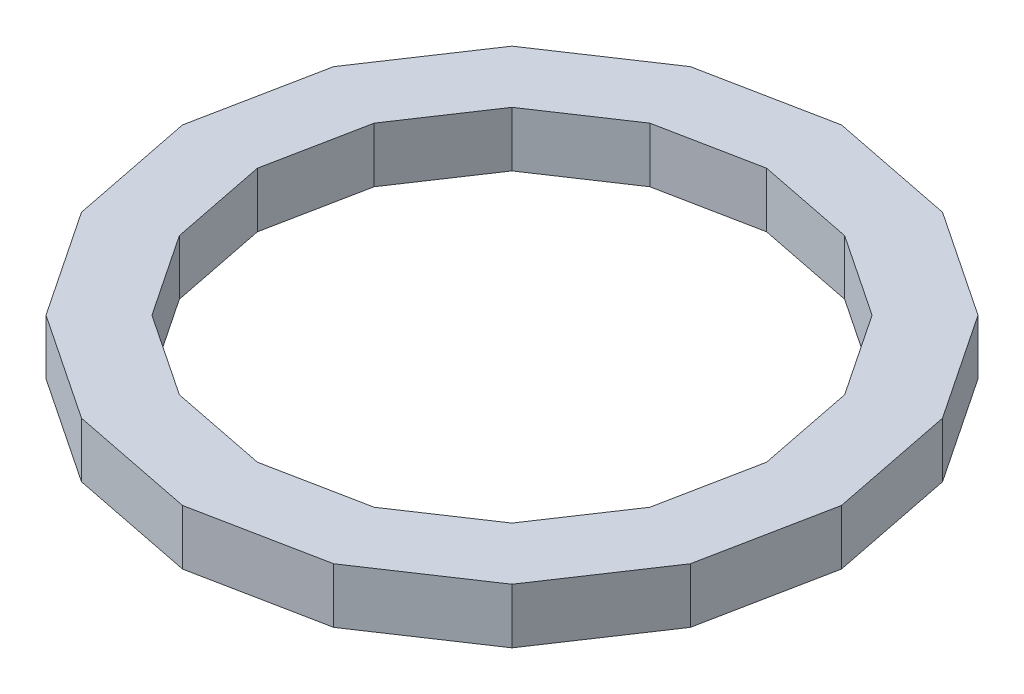
from build123d import *

# Parameters (mm, degrees)
BOSS_EXTRUDE1_DEPTH = 19.05


with BuildPart() as part:
    # Sketch1 → Boss-Extrude1 (new body)
    with BuildSketch(Plane(origin=(0, 0, 0), x_dir=(1, 0, 0), z_dir=(0, 1, 0))):
        Polygon((113.921591652, 0), (105.249826838, 43.595905714), (80.554729981, 80.554729981), (43.595905714, 105.249826838), (0, 113.921591652), (-43.595905714, 105.249826838), (-80.554729981, 80.554729981), (-105.249826838, 43.595905714), (-113.921591652, 0), (-105.249826838, -43.595905714), (-80.554729981, -80.554729981), (-43.595905714, -105.249826838), (0, -113.921591652), (43.595905714, -105.249826838), (80.554729981, -80.554729981), (105.249826838, -43.595905714), align=None)
        Polygon((88.023976234, 0), (81.323550013, 33.685317356), (62.242350502, 62.242350502), (33.685317356, 81.323550013), (0, 88.023976234), (-33.685317356, 81.323550012), (-62.242350502, 62.242350502), (-81.323550013, 33.685317356), (-88.023976234, 0), (-81.323550013, -33.685317356), (-62.242350502, -62.242350502), (-33.685317356, -81.323550013), (0, -88.023976234), (33.685317356, -81.323550013), (62.242350502, -62.242350502), (81.323550013, -33.685317356), align=None, mode=Mode.SUBTRACT)
    extrude(amount=BOSS_EXTRUDE1_DEPTH)


solid = part.part
